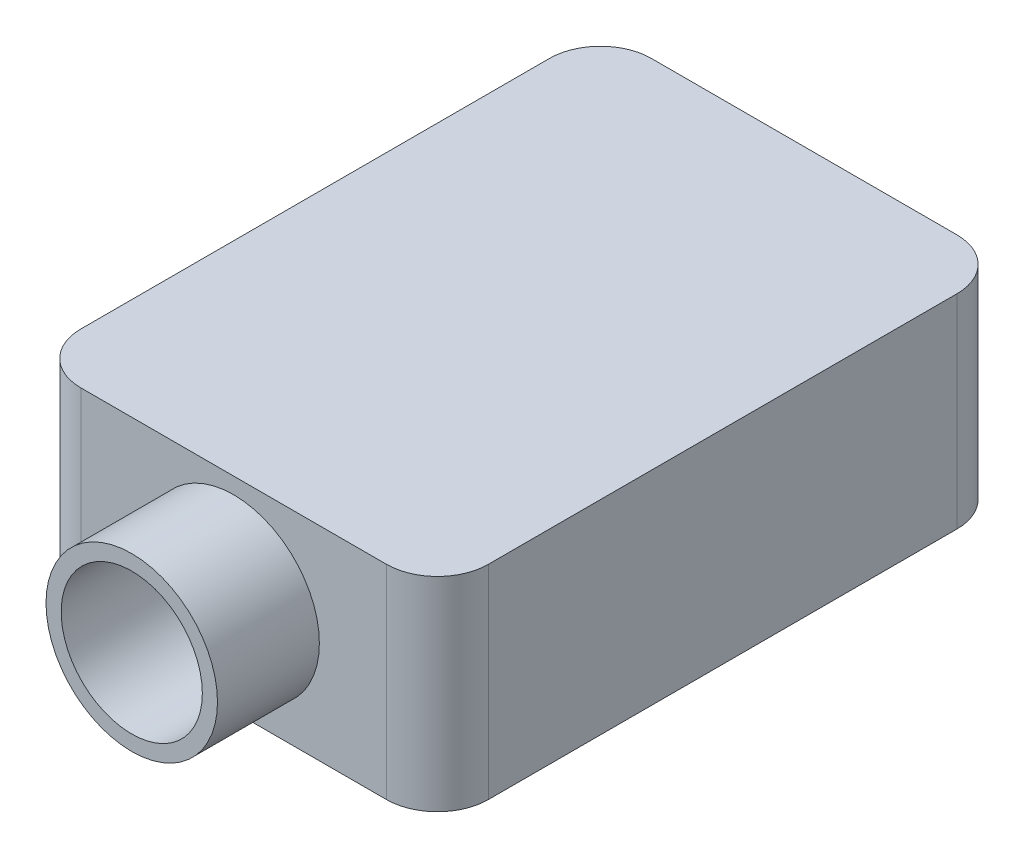
from build123d import *

# Parameters (mm, degrees)
SKETCH_2_W      = 40
SKETCH_2_H      = 56
EXTRUDE_1_DEPTH = 20
SKETCH_3_R      = 8.41555303
SKETCH_3_R_2    = 6.928356998
EXTRUDE_2_DEPTH = 10
FILLET_1_R      = 5


with BuildPart() as part:
    # 草图2 → 凸台-拉伸1 (new body)
    with BuildSketch(Plane(origin=(0, 0, 0), x_dir=(1, 0, 0), z_dir=(0, 1, 0))):
        Rectangle(SKETCH_2_W, SKETCH_2_H)
    extrude(amount=EXTRUDE_1_DEPTH)

    # 草图3 → 凸台-拉伸2 (add)
    with BuildSketch(Plane.XY.offset(28)):
        with Locations(Location((0, 10, 0), (0, 0, 180))):
            Circle(SKETCH_3_R)
        with Locations((0, 10)):
            Circle(SKETCH_3_R_2, mode=Mode.SUBTRACT)
    extrude(amount=EXTRUDE_2_DEPTH)

    # 圆角1
    fillet_1_edges = [part.edges().sort_by_distance(p)[0] for p in [
        (20, 10, 28),
        (-20, 10, 28),
        (-20, 10, -28),
        (20, 10, -28),
    ]]
    fillet(fillet_1_edges, radius=FILLET_1_R)


solid = part.part
